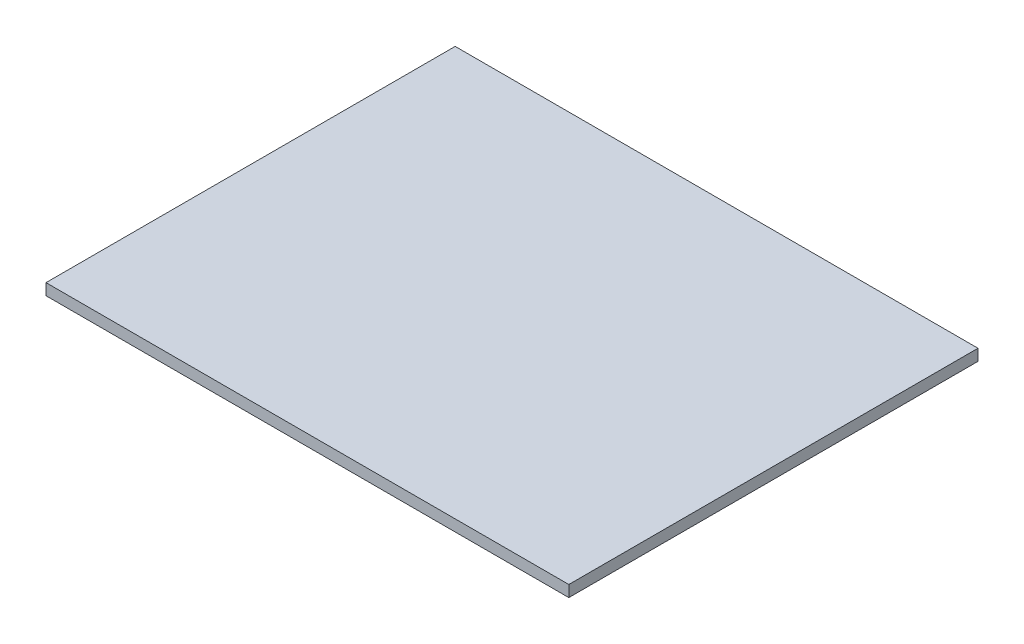
from build123d import *

# Parameters (mm, degrees)
SKETCH1_W           = 584.2
SKETCH1_H           = 457.2
BOSS_EXTRUDE1_DEPTH = 12.7


with BuildPart() as part:
    # Sketch1 → Boss-Extrude1 (new body)
    with BuildSketch(Plane(origin=(0, 0, 0), x_dir=(1, 0, 0), z_dir=(0, 1, 0))):
        with Locations((0, -228.6)):
            Rectangle(SKETCH1_W, SKETCH1_H)
    extrude(amount=BOSS_EXTRUDE1_DEPTH)


solid = part.part
